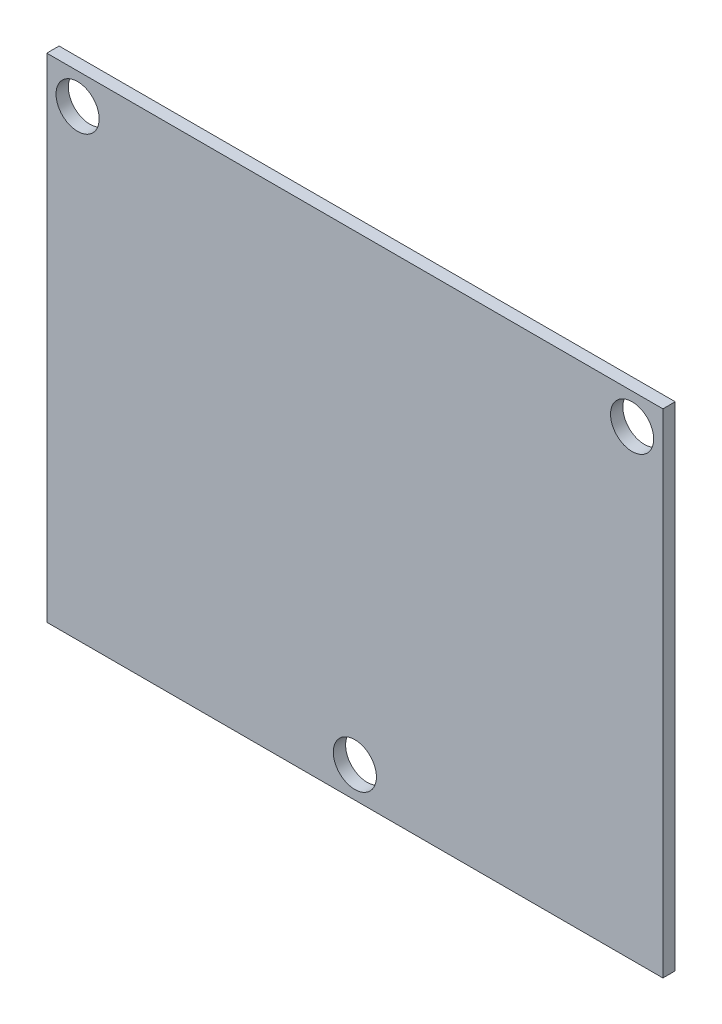
from build123d import *

# Parameters (mm, degrees)
SKETCH2_W           = 254
SKETCH2_H           = 203.2
BOSS_EXTRUDE1_DEPTH = 5.08
SKETCH3_R           = 8.89
CUT_EXTRUDE1_DEPTH  = 326.318376979


with BuildPart() as part:
    # Sketch2 → Boss-Extrude1 (new body)
    with BuildSketch(Plane.XY):
        with Locations((127, 101.6)):
            Rectangle(SKETCH2_W, SKETCH2_H)
    extrude(amount=BOSS_EXTRUDE1_DEPTH)

    # Sketch3 → Cut-Extrude1 (cut, through all)
    with BuildSketch(Plane.XY.offset(5.08)):
        with Locations((12.7, 190.5)):
            Circle(SKETCH3_R)
        with Locations((241.3, 190.5)):
            Circle(SKETCH3_R)
        with Locations((127, 12.7)):
            Circle(SKETCH3_R)
    extrude(amount=-CUT_EXTRUDE1_DEPTH, mode=Mode.SUBTRACT)


solid = part.part
